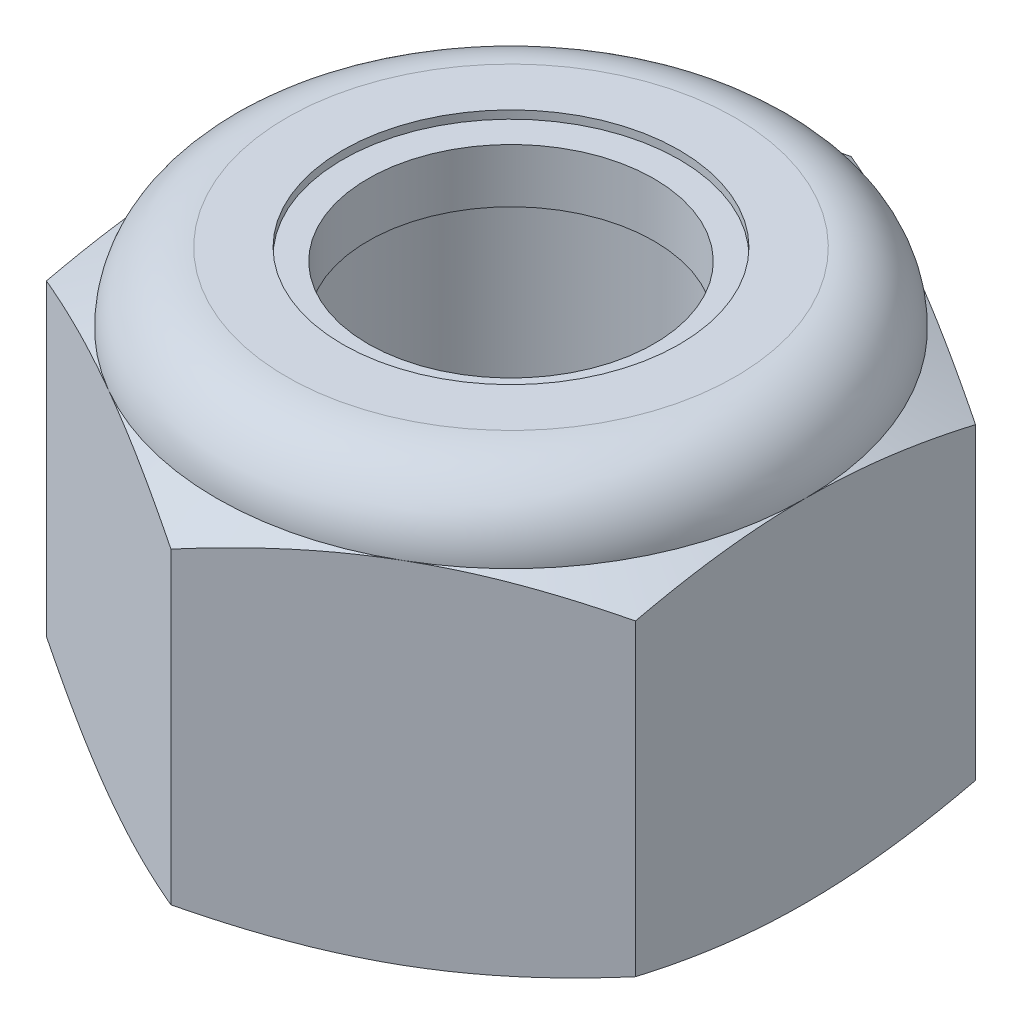
from build123d import *

# Parameters (mm, degrees)
SKETCH13_R     = 3.175
EXTRUDE1_DEPTH = 7.9375


with BuildPart() as part:
    # Sketch13 → Extrude1 (new body)
    with BuildSketch(Plane(origin=(0, 0, 0), x_dir=(1, 0, 0), z_dir=(0, 1, 0))):
        Polygon((0, 6.415804866), (-5.55625, 3.207902433), (-5.55625, -3.207902433), (0, -6.415804866), (5.55625, -3.207902433), (5.55625, 3.207902433), align=None)
        with Locations(Location((0, 0, 0), (0, 0, 270))):
            Circle(SKETCH13_R, mode=Mode.SUBTRACT)
    extrude(amount=EXTRUDE1_DEPTH)

    # Sketch5 → Cut-Revolve3 (revolve, cut)
    with BuildSketch(Plane(origin=(0, 0, 0), x_dir=(0, 0, -1), z_dir=(1, 0, 0))):
        with BuildLine():
            Line((0, 0), (5.55625, 0))
            Line((5.55625, 0), (6.415804866, 0.400817017))
            Line((6.415804866, 0.400817017), (6.415804866, 6.213766317))
            Line((6.415804866, 6.213766317), (5.55625, 6.614583333))
            ThreePointArc((5.55625, 6.614583333), (5.168776679, 7.550026679), (4.233333333, 7.9375))
            Line((4.233333333, 7.9375), (4.233333333, 9.2075))
            Line((4.233333333, 9.2075), (7.685804866, 9.2075))
            Line((7.685804866, 9.2075), (7.685804866, -1.27))
            Line((7.685804866, -1.27), (0, -1.27))
            Line((0, -1.27), (0, 0))
        make_face()
    revolve(axis=Axis((0, 0, 0), (0, 1, 0)), mode=Mode.SUBTRACT)

    # Sketch6 → Cut-Revolve4 (revolve, cut)
    with BuildSketch(Plane(origin=(0, 0, 0), x_dir=(0, 0, -1), z_dir=(1, 0, 0)), mode=Mode.PRIVATE) as cut_revolve4_sk:
        with BuildLine():
            Line((0, 6.614583333), (5.40385, 6.614583333))
            ThreePointArc((5.40385, 6.614583333), (5.061013606, 7.442263606), (4.233333333, 7.7851))
            Line((4.233333333, 7.7851), (2.116666667, 7.7851))
            Line((2.116666667, 7.7851), (2.116666667, 9.2075))
            Line((2.116666667, 9.2075), (0, 9.2075))
            Line((0, 9.2075), (0, 6.614583333))
        make_face()
    revolve(cut_revolve4_sk.sketch.rotate(Axis((0, 9.2075, 0), (0, -1, 0)), 180), axis=Axis((0, 9.2075, 0), (0, -1, 0)), mode=Mode.SUBTRACT)

    # Sketch4 → Cut-Revolve2 (revolve, cut)
    with BuildSketch(Plane(origin=(0, 0, 0), x_dir=(0, 0, -1), z_dir=(1, 0, 0))):
        Polygon((0, 6.614583333), (3.4925, 6.614583333), (0, 4.986003837), align=None)
        Polygon((0, 1.628579496), (3.4925, 0), (0, 0), align=None)
    revolve(axis=Axis((0, 0, 0), (0, 1, 0)), mode=Mode.SUBTRACT)


with BuildPart() as body_2:
    # Sketch7 → Revolve2 (revolve)
    with BuildSketch(Plane(origin=(0, 0, 0), x_dir=(0, 0, -1), z_dir=(1, 0, 0))):
        with BuildLine():
            Line((2.69875, 6.690783333), (5.324993778, 6.690783333))
            ThreePointArc((5.324993778, 6.690783333), (4.979705237, 7.4148695), (4.233333333, 7.7089))
            Line((4.233333333, 7.7089), (2.69875, 7.7089))
            Line((2.69875, 7.7089), (2.69875, 6.690783333))
        make_face()
    revolve(axis=Axis((0, 6.690783333, 0), (0, 1, 0)))


solid = Compound([part.part, body_2.part])
